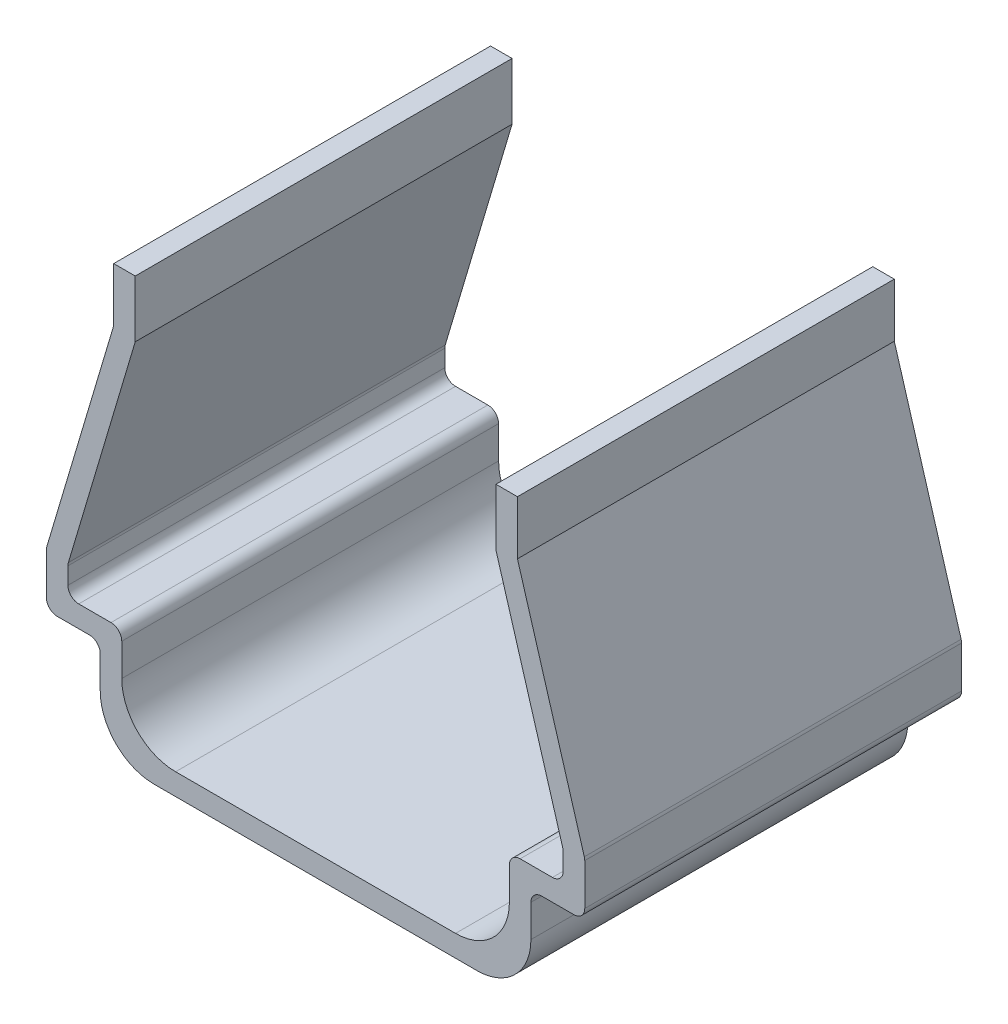
from build123d import *

# Parameters (mm, degrees)
EXTRUDE_THIN1_DEPTH = 7
FILLET1_R           = 1
FILLET2_R           = 0.2


with BuildPart() as part:
    # Sketch1 → Extrude-Thin1 (new body)
    with BuildSketch(Plane.XY):
        Polygon((3.75, 8), (3.75, 7), (5, 2.8), (5, 1.8), (4, 1.8), (4, 0), (-4, 0), (-4, 1.8), (-5, 1.8), (-5, 2.8), (-3.75, 7), (-3.75, 8), (-3.35, 8), (-3.35, 6.941738969), (-4.6, 2.741738969), (-4.6, 2.2), (-3.6, 2.2), (-3.6, 0.4), (3.6, 0.4), (3.6, 2.2), (4.6, 2.2), (4.6, 2.741738969), (3.35, 6.941738969), (3.35, 8), align=None)
    extrude(amount=EXTRUDE_THIN1_DEPTH)

    # Fillet1
    fillet1_edges = [part.edges().sort_by_distance(p)[0] for p in [
        (4, 0, 3.5),
        (-4, 0, 3.5),
        (-3.6, 0.4, 3.5),
        (3.6, 0.4, 3.5),
    ]]
    fillet(fillet1_edges, radius=FILLET1_R)

    # Fillet2
    fillet2_edges = [part.edges().sort_by_distance(p)[0] for p in [
        (5, 2.8, 3.5),
        (5, 1.8, 3.5),
        (4, 1.8, 3.5),
        (-4, 1.8, 3.5),
        (-5, 1.8, 3.5),
        (-5, 2.8, 3.5),
        (-4.6, 2.741738969, 3.5),
        (-4.6, 2.2, 3.5),
        (-3.6, 2.2, 3.5),
        (3.6, 2.2, 3.5),
        (4.6, 2.2, 3.5),
        (4.6, 2.741738969, 3.5),
    ]]
    fillet(fillet2_edges, radius=FILLET2_R)


solid = part.part
